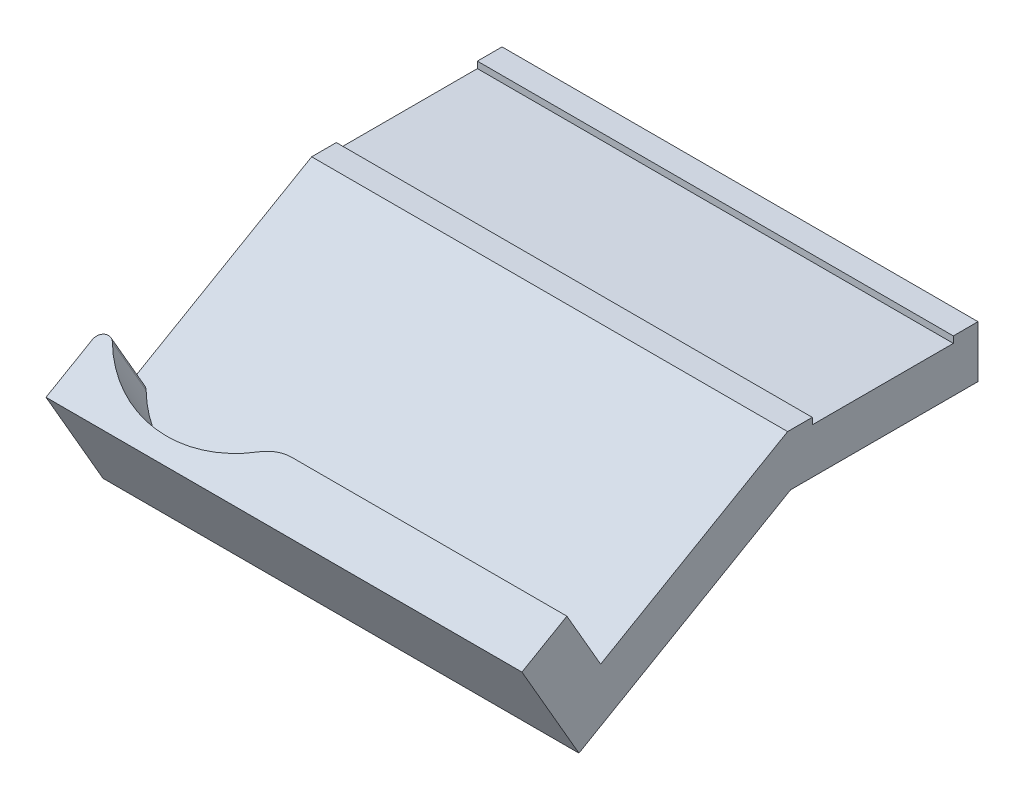
from build123d import *

# Parameters (mm, degrees)
SKETCH1_W           = 55
SKETCH1_H           = 33.9
BOSS_EXTRUDE1_DEPTH = 50
CUT_EXTRUDE1_DEPTH  = 50
CUT_EXTRUDE2_DEPTH  = 82.695838327
BOSS_EXTRUDE2_REACH = 83.696
SKETCH6_R           = 13.75
CUT_EXTRUDE3_DEPTH  = 81.101530043
CUT_EXTRUDE4_DEPTH  = 82.695838327
SKETCH8_R           = 6
CUT_EXTRUDE5_DEPTH  = 70.597672241
CUT_EXTRUDE6_DEPTH  = 70.597672241
SKETCH10_W          = 55
SKETCH10_H          = 4.5
CUT_EXTRUDE7_DEPTH  = 69.674045004
FILLET5_R           = 1
FILLET6_R           = 5
CUT_EXTRUDE8_DEPTH  = 67.56781848
SKETCH17_W          = 55
SKETCH17_H          = 6
BOSS_EXTRUDE4_DEPTH = 22
BOSS_EXTRUDE5_DEPTH = 55
SKETCH19_W          = 55
SKETCH19_H          = 16.3
CUT_EXTRUDE9_DEPTH  = 0.75
BOSS_EXTRUDE6_DEPTH = 55


with BuildPart() as part:
    # Sketch1 → Boss-Extrude1 (new body)
    with BuildSketch(Plane(origin=(0, 0, 0), x_dir=(1, 0, 0), z_dir=(0, 1, 0))):
        with Locations((27.5, 16.95)):
            Rectangle(SKETCH1_W, SKETCH1_H)
    extrude(amount=BOSS_EXTRUDE1_DEPTH)

    # Sketch4 → Cut-Extrude1 (cut)
    with BuildSketch(Plane(origin=(55, 0, 0), x_dir=(0, 0, -1), z_dir=(1, 0, 0))):
        Polygon((-18.6, 53.301270189), (24.701270189, 78.301270189), (49.701270189, 35), (6.4, 10), align=None)
    extrude(amount=-CUT_EXTRUDE1_DEPTH, mode=Mode.SUBTRACT)

    # Sketch5 → Cut-Extrude2 (cut, through all)
    with BuildSketch(Plane(origin=(55, 0, 0), x_dir=(0, 0, -1), z_dir=(1, 0, 0))):
        Polygon((-11.160254038, 20.415252187), (-2.5, 25.415252187), (2.5, 16.75499815), (-6.160254038, 11.75499815), align=None)
    extrude(amount=-CUT_EXTRUDE2_DEPTH, mode=Mode.SUBTRACT)

    # Sketch12 → Boss-Extrude2 (add, up to next)
    with BuildSketch(Plane(origin=(55, 0, 0), x_dir=(0, 0, -1), z_dir=(1, 0, 0)), mode=Mode.PRIVATE) as boss_extrude2_sk1:
        Polygon((2.5, 16.75499815), (6.4, 10), (7.7943009, 10.805), (3.8943009, 17.55999815), align=None)
    boss_extrude2_tool1 = extrude(boss_extrude2_sk1.sketch, amount=-BOSS_EXTRUDE2_REACH, mode=Mode.PRIVATE) - part.part
    add(boss_extrude2_tool1.solids().sort_by_distance((55, 13.779999, -5.14715))[0])

    # Sketch6 → Cut-Extrude3 (cut, through all)
    with BuildSketch(Plane(origin=(0, 4.728718708, 2.730127019), x_dir=(1, 0, 0), z_dir=(0, 0.8660254037844417, 0.4999999999999949))):
        with Locations((12, 22.155811238)):
            Circle(SKETCH6_R)
    extrude(amount=CUT_EXTRUDE3_DEPTH, mode=Mode.SUBTRACT)

    # Sketch7 → Cut-Extrude4 (cut, through all)
    with BuildSketch(Plane(origin=(55, 0, 0), x_dir=(0, 0, -1), z_dir=(1, 0, 0))):
        Polygon((0, 15.311622477), (6.743860378, 19.205192081), (10.643860378, 12.450193932), (102.202540378, 65.311622477), (25.408423261, 65.311622477), (0, 65.311622477), align=None)
    extrude(amount=-CUT_EXTRUDE4_DEPTH, mode=Mode.SUBTRACT)

    # Sketch8 → Cut-Extrude5 (cut, through all)
    with BuildSketch(Plane(origin=(0, 0, 0), x_dir=(1, 0, 0), z_dir=(0, 1, 0))):
        with Locations((25.75, 35.4)):
            Circle(SKETCH8_R)
    extrude(amount=CUT_EXTRUDE5_DEPTH, mode=Mode.SUBTRACT)

    # Sketch9 → Cut-Extrude6 (cut, through all)
    with BuildSketch(Plane(origin=(55, 0, 0), x_dir=(0, 0, -1), z_dir=(1, 0, 0))):
        Polygon((29.4, 23.279056191), (33.9, 23.279056191), (33.9, 25.877132403), align=None)
    extrude(amount=-CUT_EXTRUDE6_DEPTH, mode=Mode.SUBTRACT)

    # Sketch10 → Cut-Extrude7 (cut, through all)
    with BuildSketch(Plane(origin=(0, 0, 0), x_dir=(1, 0, 0), z_dir=(0, 1, 0))):
        with Locations((27.5, 31.65)):
            Rectangle(SKETCH10_W, SKETCH10_H)
    extrude(amount=CUT_EXTRUDE7_DEPTH, mode=Mode.SUBTRACT)

    # Fillet5
    fillet5_edges = [part.edges().sort_by_distance(p)[0] for p in [
        (0, 15.827693006, -8.693860378),
    ]]
    fillet(fillet5_edges, radius=FILLET5_R)

    # Fillet6
    fillet6_edges = [part.edges().sort_by_distance(p)[0] for p in [
        (21.433849499, 14.182499075, -5.8443009),
    ]]
    fillet(fillet6_edges, radius=FILLET6_R)

    # Sketch16 → Cut-Extrude8 (cut, through all)
    with BuildSketch(Plane(origin=(55, 0, 0), x_dir=(0, 0, -1), z_dir=(1, 0, 0))):
        Polygon((29.4, 17.079056191), (6.584678752, 3.906624327), (0, 15.311622477), (0, 0), (29.4, 0), align=None)
    extrude(amount=-CUT_EXTRUDE8_DEPTH, mode=Mode.SUBTRACT)

    # Sketch17 → Boss-Extrude4 (add)
    with BuildSketch(Plane(origin=(0, 0, -29.4), x_dir=(-1, 0, 0), z_dir=(0, 0, -1))):
        with Locations((-27.5, 20.279056191)):
            Rectangle(SKETCH17_W, SKETCH17_H)
    extrude(amount=BOSS_EXTRUDE4_DEPTH)

    # Sketch18 → Boss-Extrude5 (add)
    with BuildSketch(Plane(origin=(55, 0, 0), x_dir=(0, 0, -1), z_dir=(1, 0, 0))):
        Polygon((17.992339376, 10.492840259), (40.138715007, 23.279056191), (29.4, 23.279056191), (15.307660624, 15.142840259), align=None)
    extrude(amount=-BOSS_EXTRUDE5_DEPTH)

    # Sketch19 → Cut-Extrude9 (cut)
    with BuildSketch(Plane(origin=(0, 23.279056191, 0), x_dir=(1, 0, 0), z_dir=(0, 1, 0))):
        with Locations((27.5, 40.4)):
            Rectangle(SKETCH19_W, SKETCH19_H)
    extrude(amount=-CUT_EXTRUDE9_DEPTH, mode=Mode.SUBTRACT)

    # Sketch20 → Boss-Extrude6 (add)
    with BuildSketch(Plane(origin=(55, 0, 0), x_dir=(0, 0, -1), z_dir=(1, 0, 0))):
        Polygon((0, 15.311622477), (-1.299038106, 14.561622477), (5.285640646, 3.156624327), (6.584678752, 3.906624327), align=None)
    extrude(amount=-BOSS_EXTRUDE6_DEPTH)


solid = part.part
